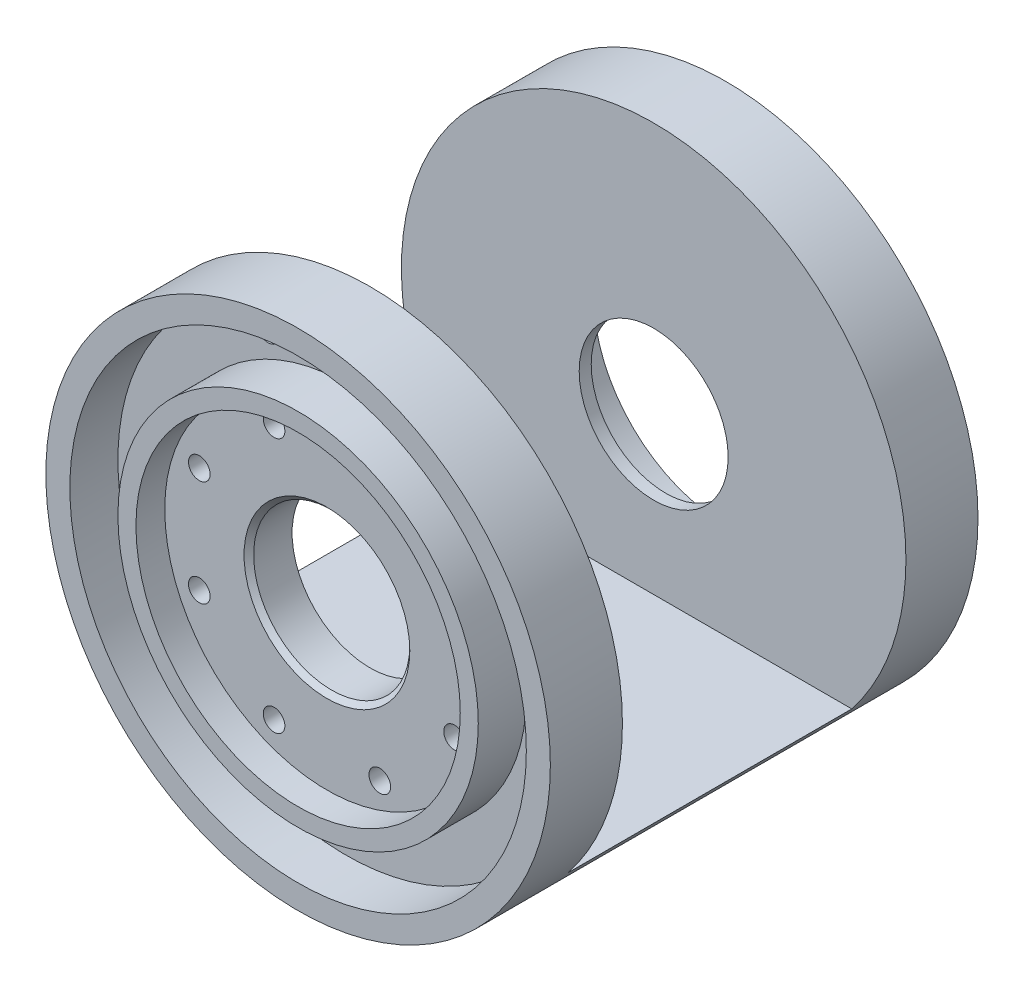
from build123d import *

# Parameters (mm, degrees)
SKETCH_1_R           = 105
EXTRUDE_1_DEPTH      = 89
CUT_EXTRUDE_1_DEPTH  = 59
SKETCH_4_R           = 95
SKETCH_4_R_2         = 75
CUT_EXTRUDE_2_DEPTH  = 20
SKETCH_5_R           = 55
CUT_EXTRUDE_3_DEPTH  = 22
SKETCH_6_R           = 50
CUT_EXTRUDE_4_DEPTH  = 3
CUT_EXTRUDE_5_REACH  = 215.211
SKETCH_7_R           = 31
CUT_EXTRUDE_START    = -20
SKETCH_8_R           = 95
SKETCH_8_R_2         = 75
CUT_EXTRUDE_6_DEPTH  = 20
SKETCH_9_R           = 67.5
CUT_EXTRUDE_7_DEPTH  = 12
CUT_EXTRUDE_8_REACH  = 224.724
SKETCH_10_R          = 32.5
CHAMFER_1_SIZE       = 2
CUT_EXTRUDE_9_REACH  = 218.827
SKETCH_11_R          = 5
CUT_EXTRUDE_10_REACH = 224.724
SKETCH_12_R          = 4.5


with BuildPart() as part:
    # 草图1 → 凸台-拉伸1 (new, symmetric)
    with BuildSketch(Plane.XY):
        Circle(SKETCH_1_R)
    extrude(amount=EXTRUDE_1_DEPTH, both=True)

    # 草图3 → 切除-拉伸1 (cut, symmetric)
    with BuildSketch(Plane.XY):
        with BuildLine():
            Line((-82.462112512, -65), (82.462112512, -65))
            ThreePointArc((82.462112512, -65), (0, 105), (-82.462112512, -65))
        make_face()
    extrude(amount=CUT_EXTRUDE_1_DEPTH, both=True, mode=Mode.SUBTRACT)

    # 草图4 → 切除-拉伸2 (cut)
    with BuildSketch(Plane(origin=(0, 0, -89), x_dir=(-1, 0, 0), z_dir=(0, 0, -1))):
        Circle(SKETCH_4_R)
        Circle(SKETCH_4_R_2, mode=Mode.SUBTRACT)
    extrude(amount=-CUT_EXTRUDE_2_DEPTH, mode=Mode.SUBTRACT)

    # 草图5 → 切除-拉伸3 (cut)
    with BuildSketch(Plane(origin=(0, 0, -89), x_dir=(-1, 0, 0), z_dir=(0, 0, -1))):
        Circle(SKETCH_5_R)
    extrude(amount=-CUT_EXTRUDE_3_DEPTH, mode=Mode.SUBTRACT)

    # 草图6 → 切除-拉伸4 (cut)
    with BuildSketch(Plane(origin=(0, 0, -67), x_dir=(-1, 0, 0), z_dir=(0, 0, -1))):
        Circle(SKETCH_6_R)
    extrude(amount=-CUT_EXTRUDE_4_DEPTH, mode=Mode.SUBTRACT)

    # 草图7 → 切除-拉伸5 (cut, up to next)
    with BuildSketch(Plane(origin=(0, 0, -64), x_dir=(-1, 0, 0), z_dir=(0, 0, -1)), mode=Mode.PRIVATE) as cut_extrude_5_sk1:
        Circle(SKETCH_7_R)
    cut_extrude_5_tool1 = extrude(cut_extrude_5_sk1.sketch, amount=-CUT_EXTRUDE_5_REACH, mode=Mode.PRIVATE) & part.part
    add(cut_extrude_5_tool1.solids().sort_by_distance((0, 0, -64))[0], mode=Mode.SUBTRACT)

    # 草图8 → 切除-拉伸6 (cut)
    with BuildSketch(Plane.XY.offset(89).offset(CUT_EXTRUDE_START)):
        with Locations(Location((0, 0, 0), (0, 0, 180))):
            Circle(SKETCH_8_R)
        with Locations(Location((0, 0, 0), (0, 0, 180))):
            Circle(SKETCH_8_R_2, mode=Mode.SUBTRACT)
    extrude(amount=CUT_EXTRUDE_6_DEPTH, mode=Mode.SUBTRACT)

    # 草图9 → 切除-拉伸7 (cut)
    with BuildSketch(Plane.XY.offset(89)):
        Circle(SKETCH_9_R)
    extrude(amount=-CUT_EXTRUDE_7_DEPTH, mode=Mode.SUBTRACT)

    # 草图10 → 切除-拉伸8 (cut, up to next)
    with BuildSketch(Plane.XY.offset(77), mode=Mode.PRIVATE) as cut_extrude_8_sk1:
        Circle(SKETCH_10_R)
    cut_extrude_8_tool1 = extrude(cut_extrude_8_sk1.sketch, amount=-CUT_EXTRUDE_8_REACH, mode=Mode.PRIVATE) & part.part
    add(cut_extrude_8_tool1.solids().sort_by_distance((0, 0, 77))[0], mode=Mode.SUBTRACT)

    # 倒角1
    chamfer_1_edges = [part.edges().sort_by_distance(p)[0] for p in [
        (-32.5, 0, 77),
    ]]
    chamfer(chamfer_1_edges, length=CHAMFER_1_SIZE)

    # 草图11 → 切除-拉伸9 (cut, up to next)
    with BuildSketch(Plane.XY.offset(69), mode=Mode.PRIVATE) as cut_extrude_9_sk1:
        with Locations((0, 85)):
            Circle(SKETCH_11_R)
    cut_extrude_9_tool1 = extrude(cut_extrude_9_sk1.sketch, amount=-CUT_EXTRUDE_9_REACH, mode=Mode.PRIVATE) & part.part
    # 草图11 → 切除-拉伸9 (cut, up to next)
    with BuildSketch(Plane.XY.offset(69), mode=Mode.PRIVATE) as cut_extrude_9_sk2:
        with Locations((32.528091751, 78.529760263)):
            Circle(SKETCH_11_R)
    cut_extrude_9_tool2 = extrude(cut_extrude_9_sk2.sketch, amount=-CUT_EXTRUDE_9_REACH, mode=Mode.PRIVATE) & part.part
    # 草图11 → 切除-拉伸9 (cut, up to next)
    with BuildSketch(Plane.XY.offset(69), mode=Mode.PRIVATE) as cut_extrude_9_sk3:
        with Locations((-32.528091751, 78.529760263)):
            Circle(SKETCH_11_R)
    cut_extrude_9_tool3 = extrude(cut_extrude_9_sk3.sketch, amount=-CUT_EXTRUDE_9_REACH, mode=Mode.PRIVATE) & part.part
    add(cut_extrude_9_tool1.solids().sort_by_distance((0, 85, 69))[0], mode=Mode.SUBTRACT)
    add(cut_extrude_9_tool2.solids().sort_by_distance((32.528092, 78.52976, 69))[0], mode=Mode.SUBTRACT)
    add(cut_extrude_9_tool3.solids().sort_by_distance((-32.528092, 78.52976, 69))[0], mode=Mode.SUBTRACT)

    # 草图12 → 切除-拉伸10 (cut, up to next)
    with BuildSketch(Plane.XY.offset(77), mode=Mode.PRIVATE) as cut_extrude_10_sk1:
        with Locations((22.004297361, 53.123073119)):
            Circle(SKETCH_12_R)
    cut_extrude_10_tool1 = extrude(cut_extrude_10_sk1.sketch, amount=-CUT_EXTRUDE_10_REACH, mode=Mode.PRIVATE) & part.part
    # 草图12 → 切除-拉伸10 (cut, up to next)
    with BuildSketch(Plane.XY.offset(77), mode=Mode.PRIVATE) as cut_extrude_10_sk2:
        with Locations((53.123073119, 22.004297361)):
            Circle(SKETCH_12_R)
    cut_extrude_10_tool2 = extrude(cut_extrude_10_sk2.sketch, amount=-CUT_EXTRUDE_10_REACH, mode=Mode.PRIVATE) & part.part
    # 草图12 → 切除-拉伸10 (cut, up to next)
    with BuildSketch(Plane.XY.offset(77), mode=Mode.PRIVATE) as cut_extrude_10_sk3:
        with Locations((53.123073119, -22.004297361)):
            Circle(SKETCH_12_R)
    cut_extrude_10_tool3 = extrude(cut_extrude_10_sk3.sketch, amount=-CUT_EXTRUDE_10_REACH, mode=Mode.PRIVATE) & part.part
    # 草图12 → 切除-拉伸10 (cut, up to next)
    with BuildSketch(Plane.XY.offset(77), mode=Mode.PRIVATE) as cut_extrude_10_sk4:
        with Locations((22.004297361, -53.123073119)):
            Circle(SKETCH_12_R)
    cut_extrude_10_tool4 = extrude(cut_extrude_10_sk4.sketch, amount=-CUT_EXTRUDE_10_REACH, mode=Mode.PRIVATE) & part.part
    # 草图12 → 切除-拉伸10 (cut, up to next)
    with BuildSketch(Plane.XY.offset(77), mode=Mode.PRIVATE) as cut_extrude_10_sk5:
        with Locations((-22.004297361, -53.123073119)):
            Circle(SKETCH_12_R)
    cut_extrude_10_tool5 = extrude(cut_extrude_10_sk5.sketch, amount=-CUT_EXTRUDE_10_REACH, mode=Mode.PRIVATE) & part.part
    # 草图12 → 切除-拉伸10 (cut, up to next)
    with BuildSketch(Plane.XY.offset(77), mode=Mode.PRIVATE) as cut_extrude_10_sk6:
        with Locations((-53.123073119, -22.004297361)):
            Circle(SKETCH_12_R)
    cut_extrude_10_tool6 = extrude(cut_extrude_10_sk6.sketch, amount=-CUT_EXTRUDE_10_REACH, mode=Mode.PRIVATE) & part.part
    # 草图12 → 切除-拉伸10 (cut, up to next)
    with BuildSketch(Plane.XY.offset(77), mode=Mode.PRIVATE) as cut_extrude_10_sk7:
        with Locations((-53.123073119, 22.004297361)):
            Circle(SKETCH_12_R)
    cut_extrude_10_tool7 = extrude(cut_extrude_10_sk7.sketch, amount=-CUT_EXTRUDE_10_REACH, mode=Mode.PRIVATE) & part.part
    # 草图12 → 切除-拉伸10 (cut, up to next)
    with BuildSketch(Plane.XY.offset(77), mode=Mode.PRIVATE) as cut_extrude_10_sk8:
        with Locations((-22.004297361, 53.123073119)):
            Circle(SKETCH_12_R)
    cut_extrude_10_tool8 = extrude(cut_extrude_10_sk8.sketch, amount=-CUT_EXTRUDE_10_REACH, mode=Mode.PRIVATE) & part.part
    add(cut_extrude_10_tool1.solids().sort_by_distance((22.004297, 53.123073, 77))[0], mode=Mode.SUBTRACT)
    add(cut_extrude_10_tool2.solids().sort_by_distance((53.123073, 22.004297, 77))[0], mode=Mode.SUBTRACT)
    add(cut_extrude_10_tool3.solids().sort_by_distance((53.123073, -22.004297, 77))[0], mode=Mode.SUBTRACT)
    add(cut_extrude_10_tool4.solids().sort_by_distance((22.004297, -53.123073, 77))[0], mode=Mode.SUBTRACT)
    add(cut_extrude_10_tool5.solids().sort_by_distance((-22.004297, -53.123073, 77))[0], mode=Mode.SUBTRACT)
    add(cut_extrude_10_tool6.solids().sort_by_distance((-53.123073, -22.004297, 77))[0], mode=Mode.SUBTRACT)
    add(cut_extrude_10_tool7.solids().sort_by_distance((-53.123073, 22.004297, 77))[0], mode=Mode.SUBTRACT)
    add(cut_extrude_10_tool8.solids().sort_by_distance((-22.004297, 53.123073, 77))[0], mode=Mode.SUBTRACT)


solid = part.part
